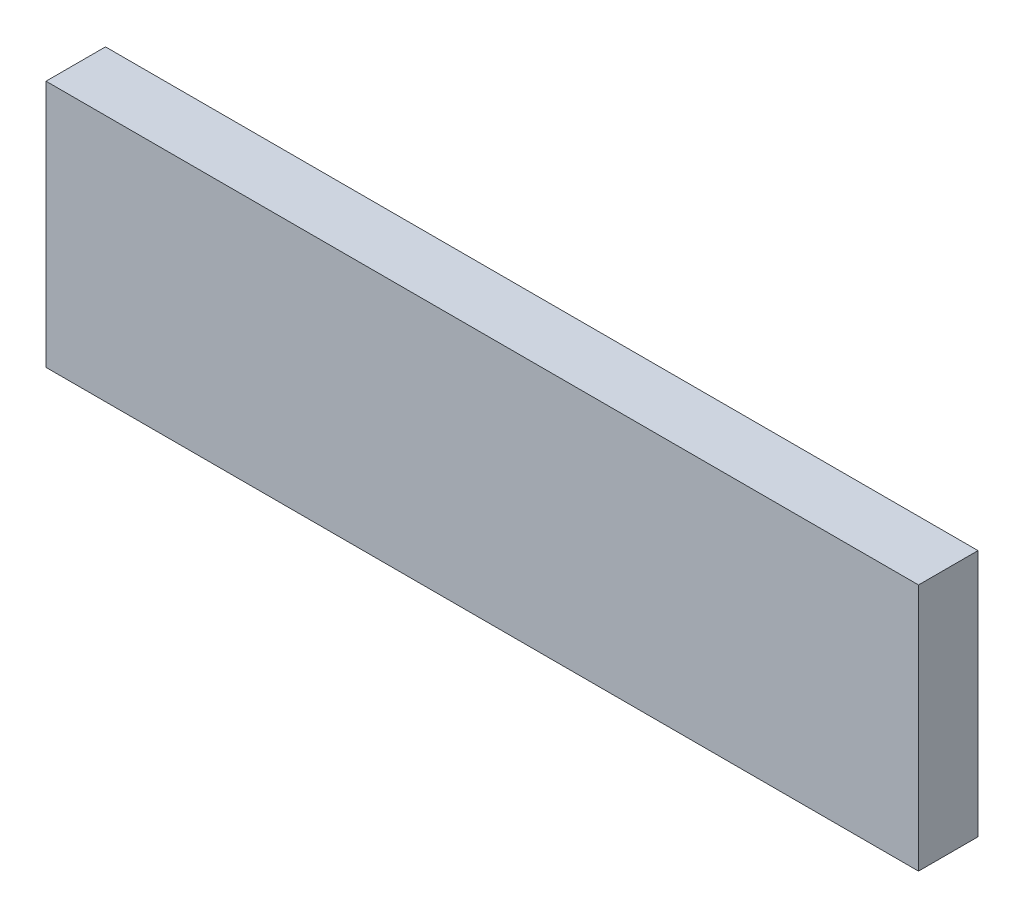
from build123d import *

# Parameters (mm, degrees)
SKETCH3_W           = 88
SKETCH3_H           = 25
BOSS_EXTRUDE3_DEPTH = 3


with BuildPart() as part:
    # Sketch3 → Boss-Extrude3 (new, symmetric)
    with BuildSketch(Plane.XY):
        Rectangle(SKETCH3_W, SKETCH3_H)
    extrude(amount=BOSS_EXTRUDE3_DEPTH, both=True)


solid = part.part
